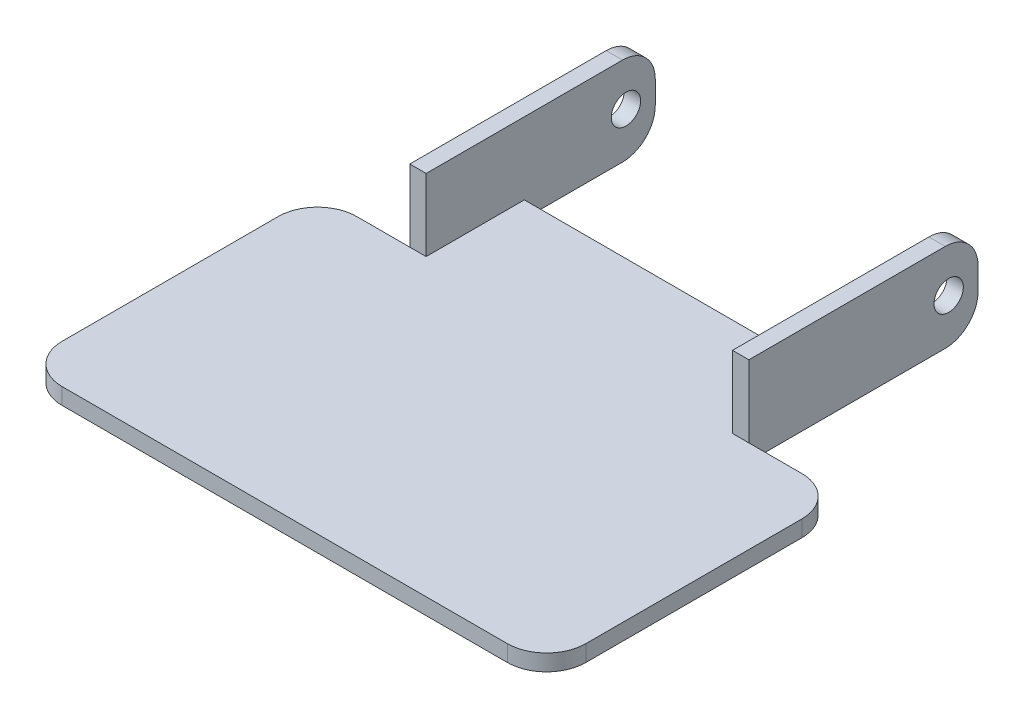
from build123d import *

# Parameters (mm, degrees)
BOSS_EXTRUDE1_DEPTH = 1.5875
SKETCH2_W           = 1.5875
SKETCH2_H           = 22.225
BOSS_EXTRUDE2_DEPTH = 6.985
FILLET1_R           = 3.175
FILLET2_R           = 3.81
HOLE1_D             = 2.8448


with BuildPart() as part:
    # Sketch1 → Boss-Extrude1 (new body)
    with BuildSketch(Plane(origin=(0, 0, 0), x_dir=(1, 0, 0), z_dir=(0, 1, 0))):
        Polygon((8.9535, 28.575), (8.9535, 50.8), (10.541, 50.8), (10.541, 38.1), (40.259, 38.1), (40.259, 50.8), (41.8465, 50.8), (41.8465, 28.575), (50.8, 28.575), (50.8, 0), (0, 0), (0, 28.575), align=None)
    extrude(amount=BOSS_EXTRUDE1_DEPTH)

    # Sketch2 → Boss-Extrude2 (add)
    with BuildSketch(Plane(origin=(0, 1.5875, 0), x_dir=(1, 0, 0), z_dir=(0, 1, 0))):
        with Locations((9.74725, 39.6875)):
            Rectangle(SKETCH2_W, SKETCH2_H)
        with Locations((41.05275, 39.6875)):
            Rectangle(SKETCH2_W, SKETCH2_H)
    extrude(amount=BOSS_EXTRUDE2_DEPTH)

    # Fillet1
    fillet1_edges = [part.edges().sort_by_distance(p)[0] for p in [
        (9.74725, 0, -50.8),
        (41.05275, 0, -50.8),
        (9.74725, 8.5725, -50.8),
        (41.05275, 8.5725, -50.8),
    ]]
    fillet(fillet1_edges, radius=FILLET1_R)

    # Fillet2
    fillet2_edges = [part.edges().sort_by_distance(p)[0] for p in [
        (0, 0.79375, -28.575),
        (50.8, 0.79375, -28.575),
        (50.8, 0.79375, 0),
        (0, 0.79375, 0),
    ]]
    fillet(fillet2_edges, radius=FILLET2_R)

    # Hole1 (through all)
    with Locations(Plane.ZY.offset(-8.9535)):
        with Locations((-47.9552, 4.28625)):
            Hole(HOLE1_D / 2)


solid = part.part
